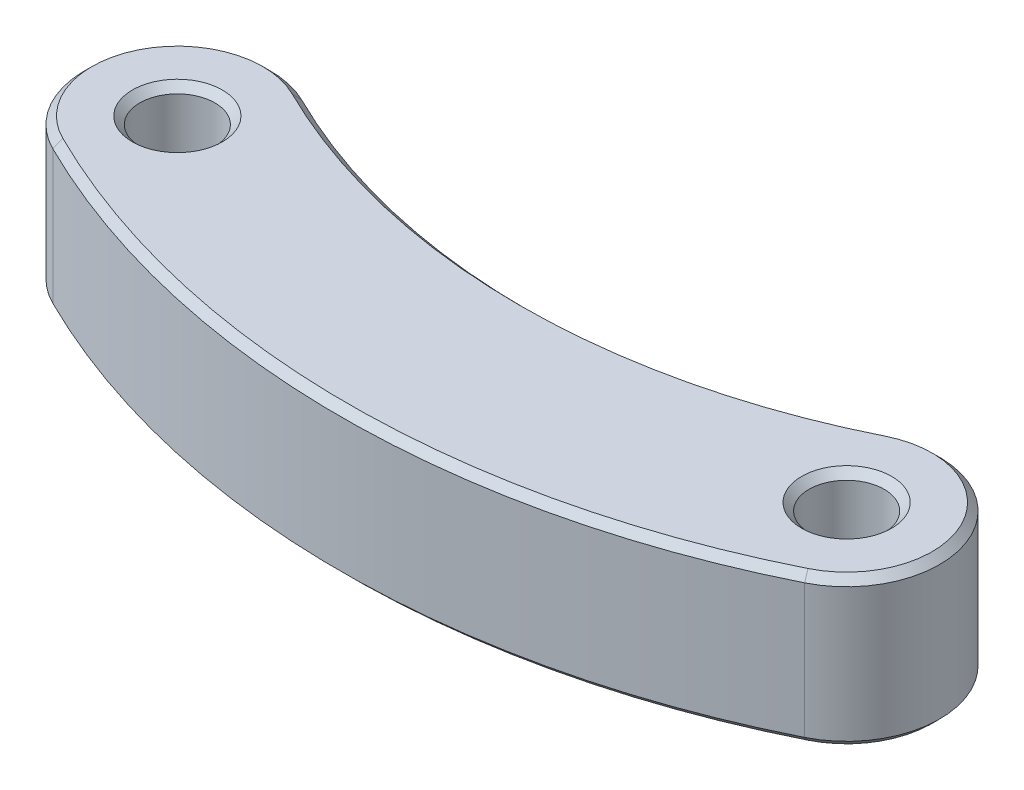
from build123d import *

# Parameters (mm, degrees)
SKETCH1_R           = 0.505
BOSS_EXTRUDE1_DEPTH = 1
CHAMFER1_SIZE       = 0.1
CHAMFER2_SIZE       = 0.1


with BuildPart() as part:
    # Sketch1 → Boss-Extrude1 (new, symmetric)
    with BuildSketch(Plane(origin=(0, 0, 0), x_dir=(1, 0, 0), z_dir=(0, 1, 0))):
        with BuildLine():
            ThreePointArc((-3.944558257, 1.11981448), (-5.61981448, 0.555441743), (-5.055441743, -1.11981448))
            ThreePointArc((-5.055441743, -1.11981448), (0, -2.304718782), (5.055441743, -1.11981448))
            ThreePointArc((5.055441743, -1.11981448), (5.61981448, 0.555441743), (3.944558257, 1.11981448))
            ThreePointArc((3.944558257, 1.11981448), (0, 0.195281218), (-3.944558257, 1.11981448))
        make_face()
        with Locations(Location((-4.5, 0, 0), (0, 0, 270))):
            Circle(SKETCH1_R, mode=Mode.SUBTRACT)
        with Locations(Location((4.5, 0, 0), (0, 0, 270))):
            Circle(SKETCH1_R, mode=Mode.SUBTRACT)
    extrude(amount=BOSS_EXTRUDE1_DEPTH, both=True)

    # Chamfer1
    chamfer1_edges = [part.edges().sort_by_distance(p)[0] for p in [
        (0, 1, 2.304718782),
        (5.61981448, 1, -0.555441743),
        (0, 1, -0.195281218),
        (5.61981448, -1, -0.555441743),
        (0, -1, 2.304718782),
        (-5.61981448, -1, -0.555441743),
        (0, -1, -0.195281218),
        (-5.61981448, 1, -0.555441743),
    ]]
    chamfer(chamfer1_edges, length=CHAMFER1_SIZE)

    # Chamfer2
    chamfer2_edges = [part.edges().sort_by_distance(p)[0] for p in [
        (-4.5, -1, -0.505),
        (-4.5, 1, -0.505),
        (4.5, -1, -0.505),
        (4.5, 1, -0.505),
    ]]
    chamfer(chamfer2_edges, length=CHAMFER2_SIZE)


solid = part.part
